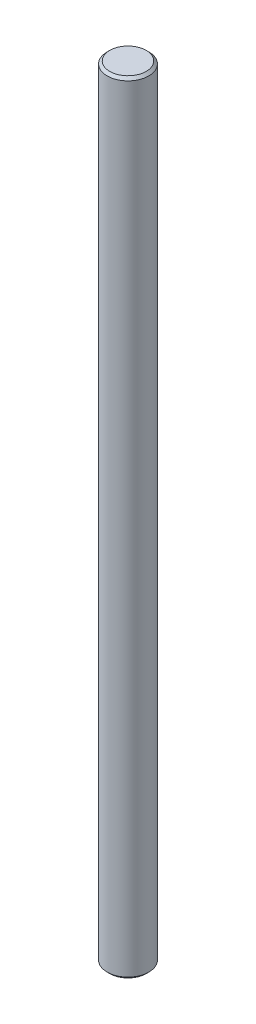
from build123d import *

# Parameters (mm, degrees)
SKETCH_1_R      = 4
EXTRUDE_1_DEPTH = 150
CHAMFER_1_SIZE  = 0.5


with BuildPart() as part:
    # Эскиз1 → Бобышка-Вытянуть1 (new body)
    with BuildSketch(Plane(origin=(0, 0, 0), x_dir=(1, 0, 0), z_dir=(0, 1, 0))):
        with Locations(Location((0, 0, 0), (0, 0, 270))):
            Circle(SKETCH_1_R)
    extrude(amount=EXTRUDE_1_DEPTH)

    # Фаска1
    chamfer_1_edges = [part.edges().sort_by_distance(p)[0] for p in [
        (0, 0, -4),
        (0, 150, -4),
    ]]
    chamfer(chamfer_1_edges, length=CHAMFER_1_SIZE)


solid = part.part
